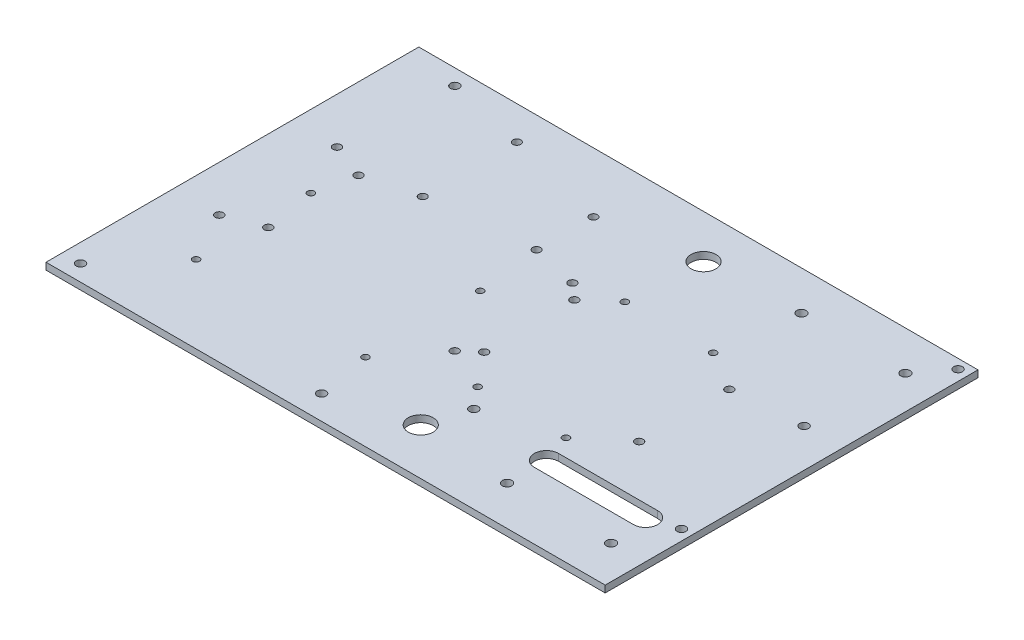
from build123d import *

# Parameters (mm, degrees)
SKETCH1_W                = 285
SKETCH1_H                = 190
SKETCH1_R                = 1.75
SKETCH1_R_2              = 2.4
SKETCH1_R_3              = 2
BOSS_EXTRUDE1_DEPTH      = 3.5
SKETCH2_R                = 1.725
JETSON_HOLES_DEPTH       = 10
SKETCH3_R                = 6.35
SWITCH_HOLES_DEPTH       = 10
SKETCH5_R                = 2.25
WIRES_AND_TRACKERS_DEPTH = 10
SKETCH6_R                = 2.05
MOUNTING_HOLES_DEPTH     = 10
SKETCH7_R                = 2.05
LIDAR_MOUNT_DEPTH        = 10


with BuildPart() as part:
    # Sketch1 → Boss-Extrude1 (new body)
    with BuildSketch(Plane(origin=(0, 0, 0), x_dir=(1, 0, 0), z_dir=(0, 1, 0))):
        with Locations((142.5, 95)):
            Rectangle(SKETCH1_W, SKETCH1_H)
        with Locations((165, 55)):
            Circle(SKETCH1_R, mode=Mode.SUBTRACT)
        with Locations((210, 55)):
            Circle(SKETCH1_R, mode=Mode.SUBTRACT)
        with Locations((215, 170)):
            Circle(SKETCH1_R_2, mode=Mode.SUBTRACT)
        with Locations((268, 170)):
            Circle(SKETCH1_R_2, mode=Mode.SUBTRACT)
        with Locations((210, 130)):
            Circle(SKETCH1_R, mode=Mode.SUBTRACT)
        with Locations((165, 130)):
            Circle(SKETCH1_R, mode=Mode.SUBTRACT)
        with Locations((67, 125)):
            Circle(SKETCH1_R_3, mode=Mode.SUBTRACT)
        with Locations((119.5, 130.5)):
            Circle(SKETCH1_R_3, mode=Mode.SUBTRACT)
        with BuildLine():
            ThreePointArc((69, 173), (68.414213562, 171.585786438), (67, 171))
            ThreePointArc((67, 171), (65.585786438, 174.414213562), (69, 173))
        make_face(mode=Mode.SUBTRACT)
        with BuildLine():
            ThreePointArc((119.5, 157.5), (117.5, 159.5), (119.5, 161.5))
            ThreePointArc((119.5, 161.5), (121.5, 159.5), (119.5, 157.5))
        make_face(mode=Mode.SUBTRACT)
        with Locations((268, 20)):
            Circle(SKETCH1_R_2, mode=Mode.SUBTRACT)
        with Locations((215, 20)):
            Circle(SKETCH1_R_2, mode=Mode.SUBTRACT)
    extrude(amount=BOSS_EXTRUDE1_DEPTH)

    # Sketch2 → Jetson Holes (cut)
    with BuildSketch(Plane(origin=(0, 3.5, 0), x_dir=(1, 0, 0), z_dir=(0, 1, 0))):
        with Locations((37, 39.5)):
            Circle(SKETCH2_R)
        with Locations((37, 98)):
            Circle(SKETCH2_R)
        with Locations((123.3, 98)):
            Circle(SKETCH2_R)
        with Locations((123.3, 39.5)):
            Circle(SKETCH2_R)
    extrude(amount=-JETSON_HOLES_DEPTH, mode=Mode.SUBTRACT)

    # Sketch3 → switch holes (cut)
    with BuildSketch(Plane(origin=(0, 3.5, 0), x_dir=(1, 0, 0), z_dir=(0, 1, 0))):
        with Locations((167.296262876, 23.68564224)):
            Circle(SKETCH3_R)
        with Locations((167.296262876, 167.817050275)):
            Circle(SKETCH3_R)
    extrude(amount=-SWITCH_HOLES_DEPTH, mode=Mode.SUBTRACT)

    # Sketch5 → Wires and trackers (cut)
    with BuildSketch(Plane(origin=(0, 3.5, 0), x_dir=(1, 0, 0), z_dir=(0, 1, 0))):
        with Locations((173.809093187, 44.240172362)):
            Circle(SKETCH5_R)
        with Locations((9.328490985, 8.27715501)):
            Circle(SKETCH5_R)
        with Locations((26.341972093, 182.045088306)):
            Circle(SKETCH5_R)
        with Locations((279.649236993, 185.189806704)):
            Circle(SKETCH5_R)
        with Locations((265.450893748, 120.912595142)):
            Circle(SKETCH5_R)
        with Locations((279.649236993, 44.240172362)):
            Circle(SKETCH5_R)
        with Locations((128.170746294, 12.293329537)):
            Circle(SKETCH5_R)
        with BuildLine():
            Line((215, 46.226982274), (265.510732016, 46.226982274))
            ThreePointArc((265.510732016, 46.226982274), (271.666947369, 40.070766921), (265.510732016, 33.914551567))
            Line((265.510732016, 33.914551567), (215, 33.914551567))
            ThreePointArc((215, 33.914551567), (208.843784647, 40.070766921), (215, 46.226982274))
        make_face()
    extrude(amount=-WIRES_AND_TRACKERS_DEPTH, mode=Mode.SUBTRACT)

    # Sketch6 → Mounting holes (cut)
    with BuildSketch(Plane(origin=(0, 3.5, 0), x_dir=(1, 0, 0), z_dir=(0, 1, 0))):
        with Locations((41.27533381, 118)):
            Circle(SKETCH6_R)
        with Locations((151.27533381, 118)):
            Circle(SKETCH6_R)
        with Locations((230.27533381, 118)):
            Circle(SKETCH6_R)
        with Locations((230.27533381, 72)):
            Circle(SKETCH6_R)
        with Locations((151.27533381, 72)):
            Circle(SKETCH6_R)
        with Locations((41.27533381, 72)):
            Circle(SKETCH6_R)
    extrude(amount=-MOUNTING_HOLES_DEPTH, mode=Mode.SUBTRACT)

    # Sketch7 → Lidar Mount (cut)
    with BuildSketch(Plane(origin=(0, 3.5, 0), x_dir=(1, 0, 0), z_dir=(0, 1, 0))):
        with Locations((143.3, 125)):
            Circle(SKETCH7_R)
        with Locations((23.3, 125)):
            Circle(SKETCH7_R)
        with Locations((143.3, 65)):
            Circle(SKETCH7_R)
        with Locations((23.3, 65)):
            Circle(SKETCH7_R)
    extrude(amount=-LIDAR_MOUNT_DEPTH, mode=Mode.SUBTRACT)


solid = part.part
